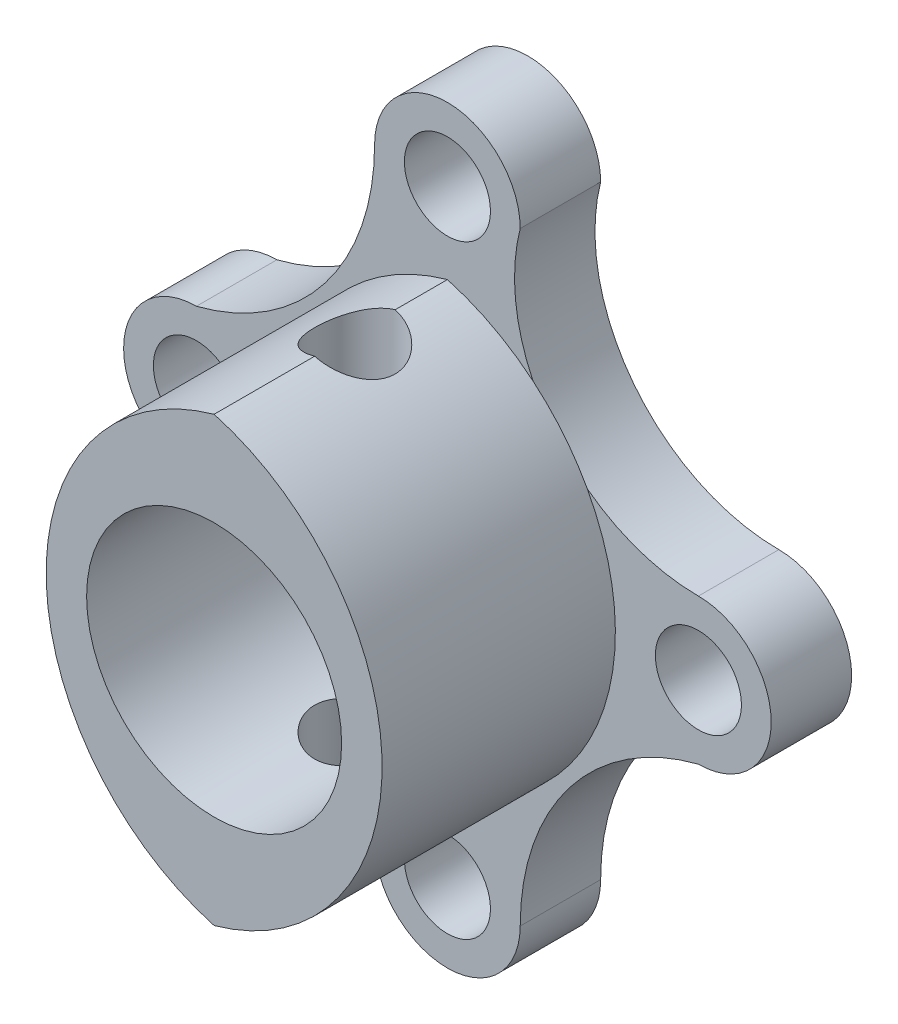
from build123d import *

# Parameters (mm, degrees)
SKETCH1_R               = 1.3589
EXTRUDE1_DEPTH          = 2.54
EXTRUDE2_DEPTH          = 7.366
SKETCH3_R               = 4.0259
CUT_EXTRUDE1_DEPTH      = 19.513485712
CUT_EXTRUDE2_DEPTH      = 19.513485712
CUT_EXTRUDE2_DEPTH_BACK = 7.366
SKETCH4_R               = 1.27


with BuildPart() as part:
    # Sketch1 → Extrude1 (new body)
    with BuildSketch(Plane.XY):
        with BuildLine():
            ThreePointArc((7.9248, 2.2987), (3.603126127, 4.22759635), (2.153092948, 8.732583583))
            ThreePointArc((2.153092948, 8.732583583), (2.211696246, 9.137709934), (2.2987, 9.5377))
            ThreePointArc((2.2987, 9.5377), (0, 11.8364), (-2.2987, 9.5377))
            ThreePointArc((-2.2987, 9.5377), (-3.870608713, 4.953593702), (-7.9248, 2.2987))
            ThreePointArc((-7.9248, 2.2987), (-10.2235, 0), (-7.9248, -2.2987))
            ThreePointArc((-7.9248, -2.2987), (-3.603126127, -4.22759635), (-2.153092948, -8.732583583))
            ThreePointArc((-2.153092948, -8.732583583), (-2.211696246, -9.137709934), (-2.2987, -9.5377))
            ThreePointArc((-2.2987, -9.5377), (0, -11.8364), (2.2987, -9.5377))
            ThreePointArc((2.2987, -9.5377), (3.870608713, -4.953593702), (7.9248, -2.2987))
            ThreePointArc((7.9248, -2.2987), (10.2235, 0), (7.9248, 2.2987))
        make_face()
        with Locations((0, -9.5377)):
            Circle(SKETCH1_R, mode=Mode.SUBTRACT)
        with Locations((-7.9248, 0)):
            Circle(SKETCH1_R, mode=Mode.SUBTRACT)
        with Locations((7.9248, 0)):
            Circle(SKETCH1_R, mode=Mode.SUBTRACT)
        with Locations((0, 9.5377)):
            Circle(SKETCH1_R, mode=Mode.SUBTRACT)
    extrude(amount=EXTRUDE1_DEPTH)

    # Sketch2 → Extrude2 (add)
    with BuildSketch(Plane.XY.offset(2.54)):
        with BuildLine():
            ThreePointArc((0, 6.990319603), (-5.303505549, 0), (0, -6.990319603))
            ThreePointArc((0, -6.990319603), (5.303505549, 0), (0, 6.990319603))
        make_face()
    extrude(amount=EXTRUDE2_DEPTH)

    # Sketch3 → Cut-Extrude1 (cut, through all)
    with BuildSketch(Plane.XY.offset(9.906)):
        Circle(SKETCH3_R)
    extrude(amount=-CUT_EXTRUDE1_DEPTH, mode=Mode.SUBTRACT)

    # Sketch4 → Cut-Extrude2 (cut, two sides: drawn at the far end of the back side and taken through both)
    with BuildSketch(Plane(origin=(0, 0, 0), x_dir=(1, 0, 0), z_dir=(0, 1, 0)).offset(-CUT_EXTRUDE2_DEPTH_BACK)):
        with Locations(Location((0, -5.461, 0), (0, 0, 270))):
            Circle(SKETCH4_R)
    extrude(amount=CUT_EXTRUDE2_DEPTH + CUT_EXTRUDE2_DEPTH_BACK, mode=Mode.SUBTRACT)


solid = part.part
